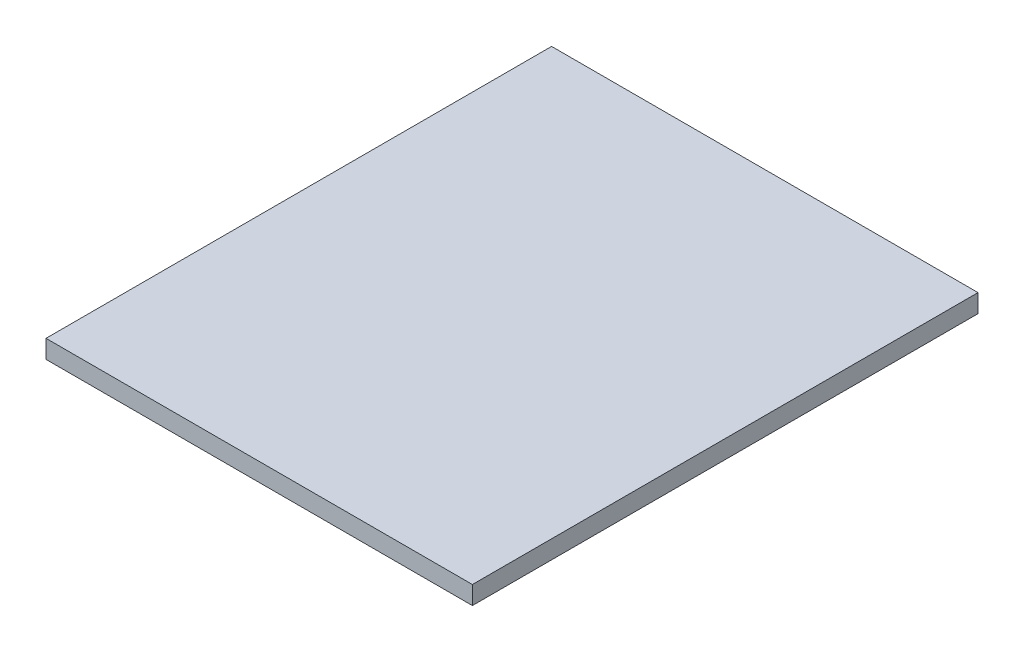
from build123d import *

# Parameters (mm, degrees)
SKETCH1_W           = 70
SKETCH1_H           = 83
BOSS_EXTRUDE1_DEPTH = 3


with BuildPart() as part:
    # Sketch1 → Boss-Extrude1 (new body)
    with BuildSketch(Plane(origin=(0, 0, 0), x_dir=(1, 0, 0), z_dir=(0, 1, 0))):
        Rectangle(SKETCH1_W, SKETCH1_H)
    extrude(amount=BOSS_EXTRUDE1_DEPTH)


solid = part.part
